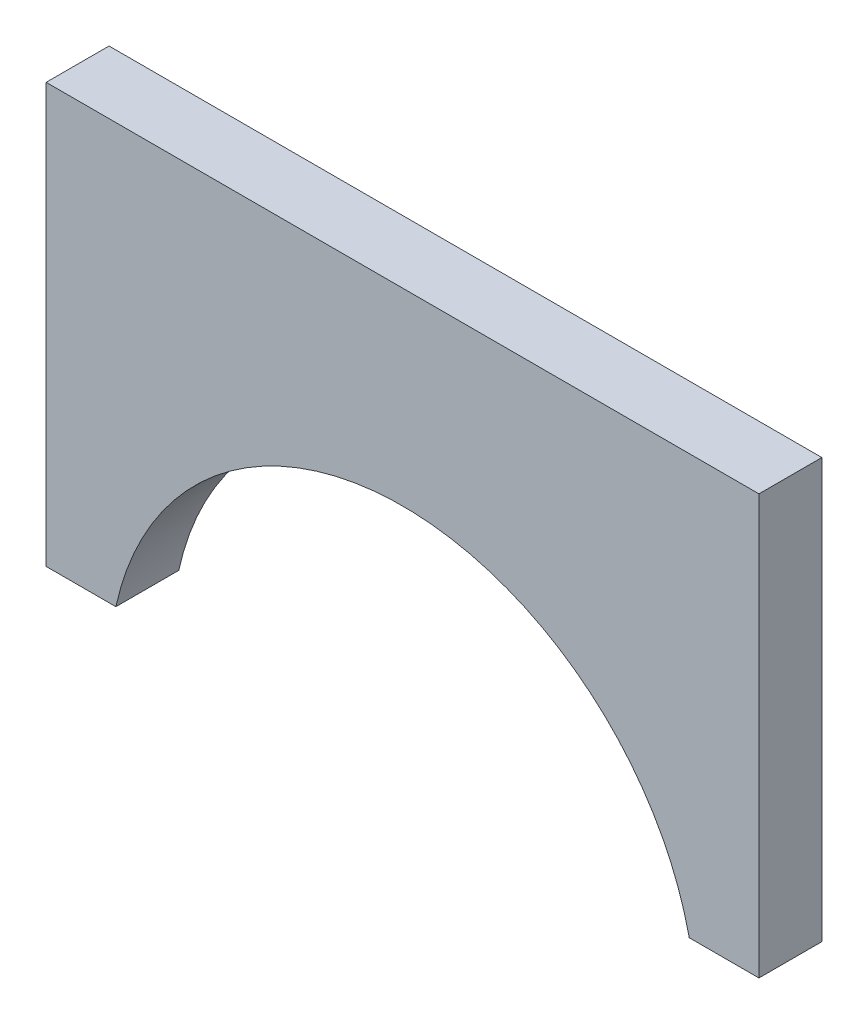
from build123d import *

# Parameters (mm, degrees)
BOSS_EXTRUDE1_DEPTH = 3


with BuildPart() as part:
    # Sketch1 → Boss-Extrude1 (new body)
    with BuildSketch(Plane.XY):
        with BuildLine():
            Line((13.674794331, -10), (17, -10))
            Line((17, -10), (17, 10))
            Line((17, 10), (-17, 10))
            Line((-17, 10), (-17, -10))
            Line((-17, -10), (-13.674794331, -10))
            ThreePointArc((-13.674794331, -10), (0, 1), (13.674794331, -10))
        make_face()
    extrude(amount=BOSS_EXTRUDE1_DEPTH)


solid = part.part
